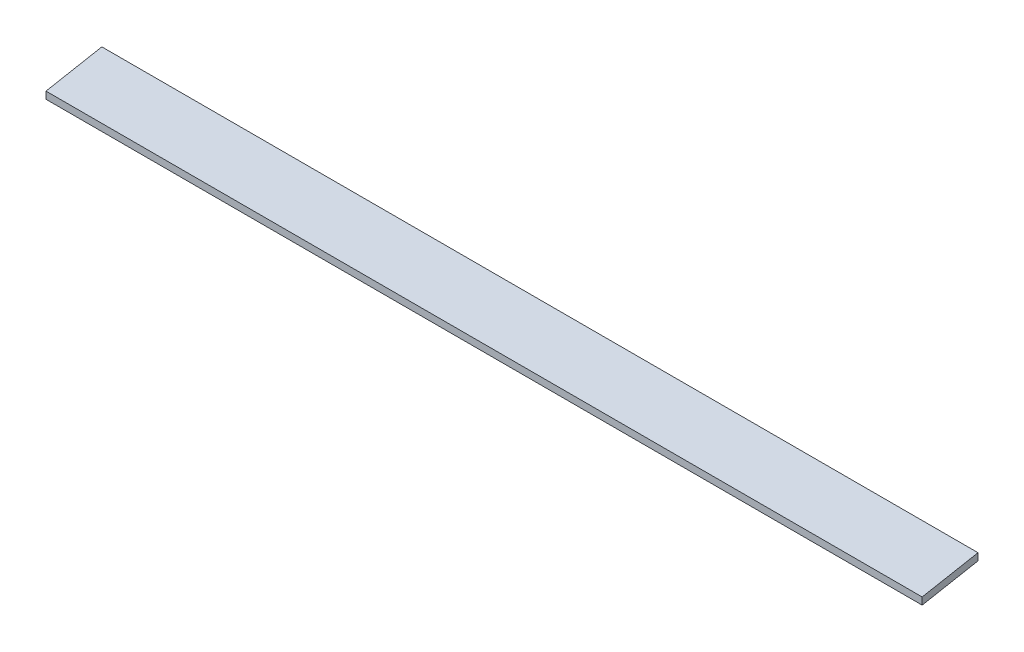
from build123d import *

# Parameters (mm, degrees)
EXTRUDE_1_DEPTH = 6170


with BuildPart() as part:
    # Эскиз1 → Бобышка-Вытянуть1 (new body)
    with BuildSketch(Plane(origin=(0, 0, 0), x_dir=(0, 0, -1), z_dir=(1, 0, 0))):
        Polygon((337.991902916, 112.516725537), (-55.238518989, 39.237565549), (-55.238518989, -10.762434451), (337.991902916, 62.516725537), align=None)
    extrude(amount=EXTRUDE_1_DEPTH)


solid = part.part
